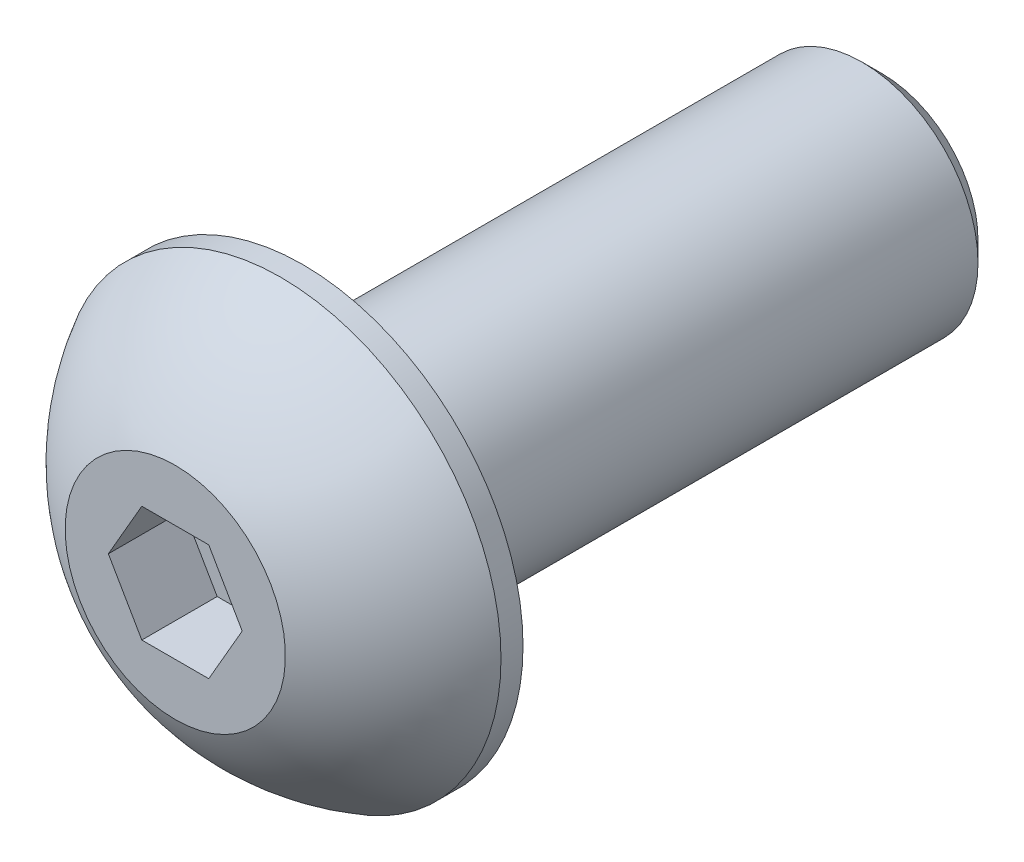
from build123d import *

# Parameters (mm, degrees)
CUT_EXTRUDE1_DEPTH = 1.3
CHAMFER1_SIZE      = 0.35
FILLET1_R          = 0.2


with BuildPart() as part:
    # Sketch1 → Revolve1 (revolve)
    with BuildSketch(Plane(origin=(0, 0, 0), x_dir=(0, 0, -1), z_dir=(1, 0, 0))):
        with BuildLine():
            Line((-0.38, 3.8), (0, 3.8))
            Line((0, 3.8), (0, 2))
            Line((0, 2), (10, 2))
            Line((10, 2), (10, 0))
            Line((10, 0), (-2.2, 0))
            Line((-2.2, 0), (-2.2, 1.9))
            ThreePointArc((-2.2, 1.9), (-1.437986341, 2.991755338), (-0.38, 3.8))
        make_face()
    revolve(axis=Axis((0, 0, -10), (0, 0, 1)))

    # Sketch2 → Cut-Extrude1 (cut)
    with BuildSketch(Plane.XY.offset(2.2)):
        Polygon((1.154700538, 0), (0.577350269, 1), (-0.577350269, 1), (-1.154700538, 0), (-0.577350269, -1), (0.577350269, -1), align=None)
    extrude(amount=-CUT_EXTRUDE1_DEPTH, mode=Mode.SUBTRACT)

    # Chamfer1
    chamfer1_edges = [part.edges().sort_by_distance(p)[0] for p in [
        (0, -2, -10),
    ]]
    chamfer(chamfer1_edges, length=CHAMFER1_SIZE)

    # Fillet1
    fillet1_edges = [part.edges().sort_by_distance(p)[0] for p in [
        (0, -2, 0),
    ]]
    fillet(fillet1_edges, radius=FILLET1_R)


solid = part.part
